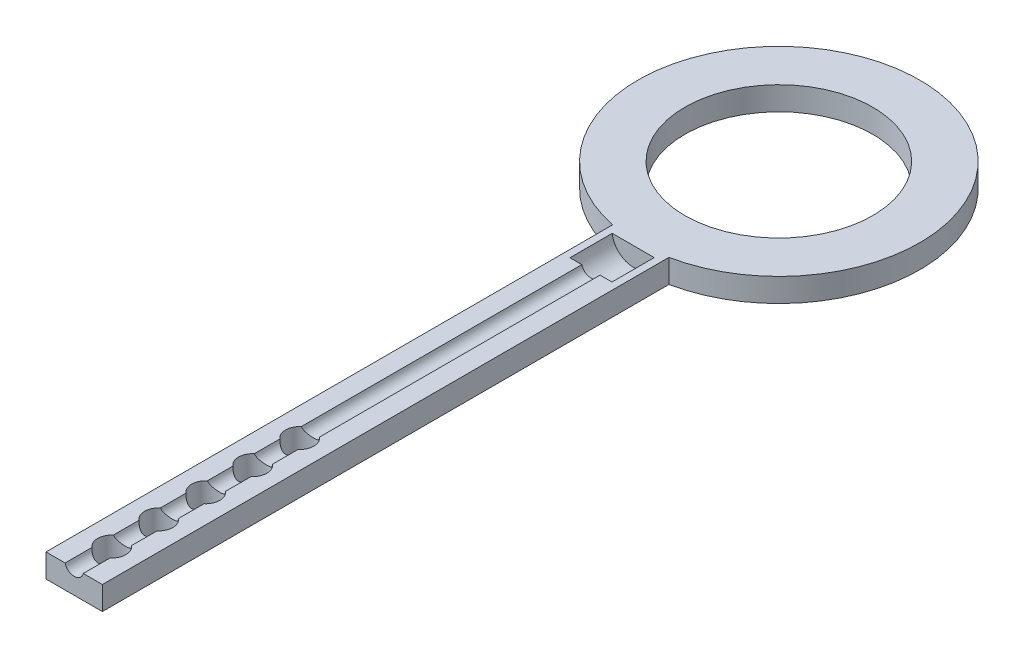
from build123d import *

# Parameters (mm, degrees)
SKETCH1_R           = 20
BOSS_EXTRUDE1_DEPTH = 5
SKETCH2_R           = 3
CUT_EXTRUDE1_DEPTH  = 10
LPATTERN1_COUNT     = 5
LPATTERN1_PITCH     = 10
SKETCH3_R           = 2
CUT_EXTRUDE2_DEPTH  = 116
CUT_EXTRUDE3_START  = -110
SKETCH4_R           = 4.5
CUT_EXTRUDE3_DEPTH  = 9


with BuildPart() as part:
    # Sketch1 → Boss-Extrude1 (new body)
    with BuildSketch(Plane(origin=(0, 0, 0), x_dir=(1, 0, 0), z_dir=(0, 1, 0))):
        with BuildLine():
            Line((-6, -29.393876913), (-6, -150))
            Line((-6, -150), (6, -150))
            Line((6, -150), (6, -29.393876913))
            ThreePointArc((6, -29.393876913), (0, 30), (-6, -29.393876913))
        make_face()
        with Locations(Location((0, 0, 0), (0, 0, 270))):
            Circle(SKETCH1_R, mode=Mode.SUBTRACT)
    extrude(amount=BOSS_EXTRUDE1_DEPTH)

    # Sketch2 → Cut-Extrude1 (cut)
    with BuildSketch(Plane(origin=(0, 5, 0), x_dir=(1, 0, 0), z_dir=(0, 1, 0))):
        with Locations(Location((0, -142, 0), (0, 0, 270))):
            Circle(SKETCH2_R)
    cut_extrude1 = extrude(amount=-CUT_EXTRUDE1_DEPTH, mode=Mode.SUBTRACT)

    # LPattern1: Cut-Extrude1 ×5
    with Locations(*[(0, 0, -i * LPATTERN1_PITCH) for i in range(1, LPATTERN1_COUNT)]):
        add(cut_extrude1, mode=Mode.SUBTRACT)

    # Sketch3 → Cut-Extrude2 (cut)
    with BuildSketch(Plane.XY.offset(150)):
        with Locations((0, 5.5)):
            Circle(SKETCH3_R)
    extrude(amount=-CUT_EXTRUDE2_DEPTH, mode=Mode.SUBTRACT)

    # Sketch4 → Cut-Extrude3 (cut)
    with BuildSketch(Plane.XY.offset(150).offset(CUT_EXTRUDE3_START)):
        with Locations((0, 5.5)):
            Circle(SKETCH4_R)
    extrude(amount=-CUT_EXTRUDE3_DEPTH, mode=Mode.SUBTRACT)


solid = part.part
